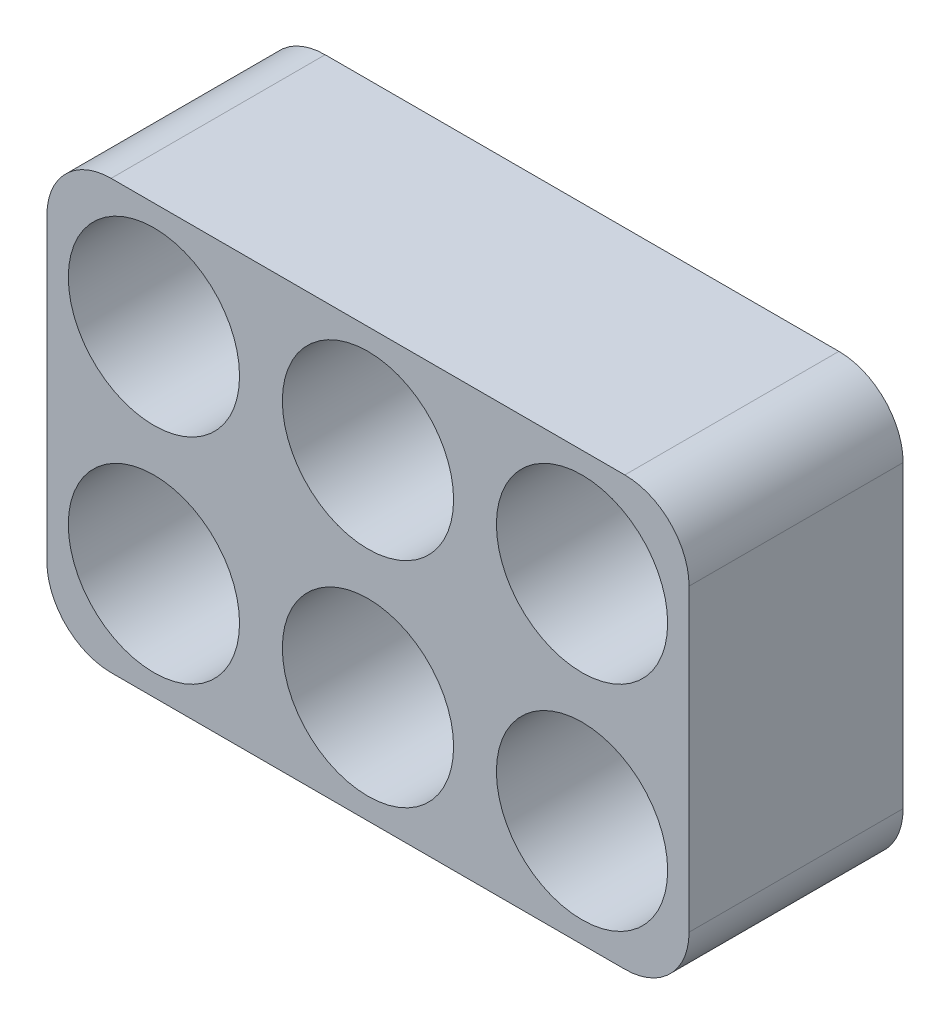
from build123d import *

# Parameters (mm, degrees)
SKETCH_1_R      = 4
EXTRUDE_1_DEPTH = 10


with BuildPart() as part:
    # 草图1 → 凸台-拉伸1 (new body)
    with BuildSketch(Plane.XY):
        with BuildLine():
            Line((-12, -10), (12, -10))
            ThreePointArc((12, -10), (14.121320344, -9.121320344), (15, -7))
            Line((15, -7), (15, 7))
            ThreePointArc((15, 7), (14.121320344, 9.121320344), (12, 10))
            Line((12, 10), (-12, 10))
            ThreePointArc((-12, 10), (-14.121320344, 9.121320344), (-15, 7))
            Line((-15, 7), (-15, -7))
            ThreePointArc((-15, -7), (-14.121320344, -9.121320344), (-12, -10))
        make_face()
        with Locations((-10, 5)):
            Circle(SKETCH_1_R, mode=Mode.SUBTRACT)
        with Locations((0, 5)):
            Circle(SKETCH_1_R, mode=Mode.SUBTRACT)
        with Locations((10, 5)):
            Circle(SKETCH_1_R, mode=Mode.SUBTRACT)
        with Locations((0, -5)):
            Circle(SKETCH_1_R, mode=Mode.SUBTRACT)
        with Locations((10, -5)):
            Circle(SKETCH_1_R, mode=Mode.SUBTRACT)
        with Locations((-10, -5)):
            Circle(SKETCH_1_R, mode=Mode.SUBTRACT)
    extrude(amount=EXTRUDE_1_DEPTH)


solid = part.part
